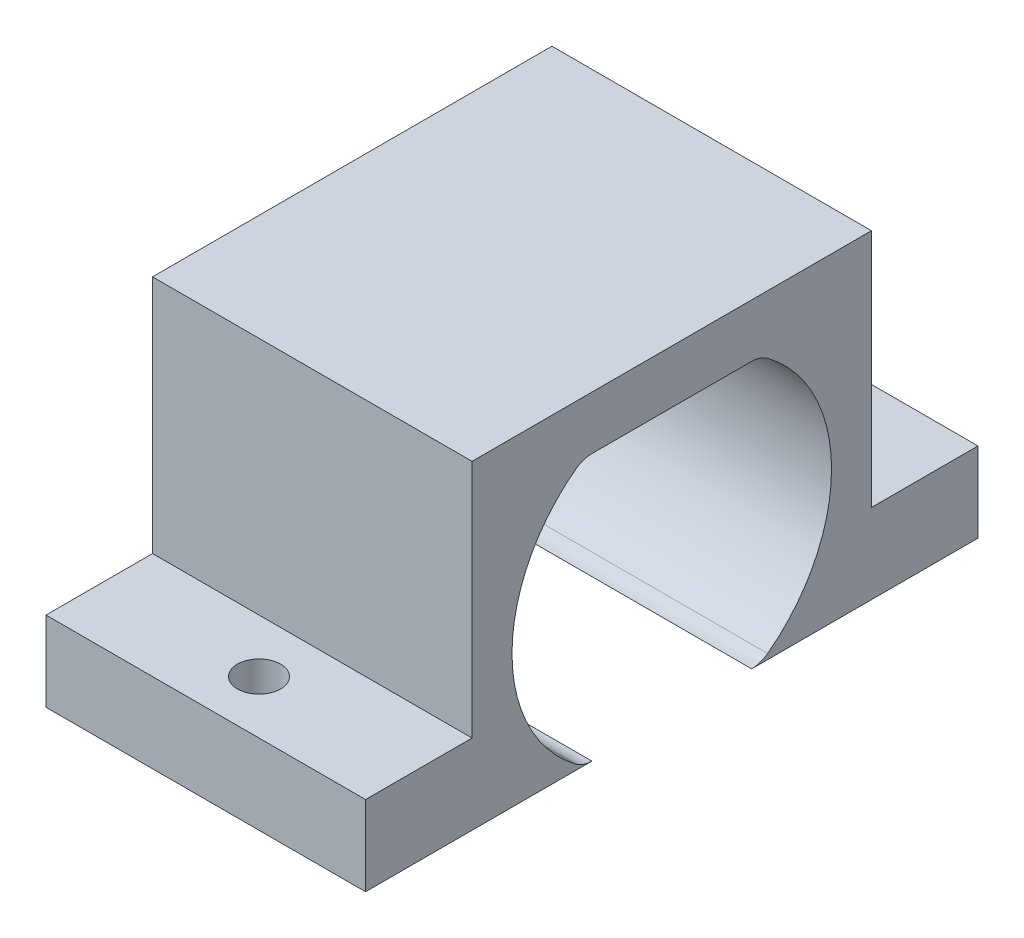
from build123d import *

# Parameters (mm, degrees)
CROQUIS1_W              = 4
CROQUIS1_H              = 3
CROQUIS1_W_2            = 15
CROQUIS1_H_2            = 12
SALIENTE_EXTRUIR1_DEPTH = 12
CORTAR_EXTRUIR2_DEPTH   = 12
CROQUIS5_R              = 0.81
CORTAR_EXTRUIR3_DEPTH   = 3


with BuildPart() as part:
    # Croquis1 → Saliente-Extruir1 (new body)
    with BuildSketch(Plane(origin=(0, 0, 0), x_dir=(0, 0, -1), z_dir=(1, 0, 0))):
        with Locations((-9.5, -4.5)):
            Rectangle(CROQUIS1_W, CROQUIS1_H)
        Rectangle(CROQUIS1_W_2, CROQUIS1_H_2)
        with Locations((9.5, -4.5)):
            Rectangle(CROQUIS1_W, CROQUIS1_H)
    extrude(amount=SALIENTE_EXTRUIR1_DEPTH)

    # Croquis4 → Cortar-Extruir2 (cut)
    with BuildSketch(Plane(origin=(12, 0, 0), x_dir=(0, 0, -1), z_dir=(1, 0, 0))):
        with BuildLine():
            Line((-3, -6), (3, -6))
            ThreePointArc((3, -6), (3.316227766, -5.948683298), (3.6, -5.8))
            ThreePointArc((3.6, -5.8), (6, -1), (3.6, 3.799999999))
            ThreePointArc((3.6, 3.799999999), (3.316227766, 3.948683297), (3, 3.999999999))
            Line((3, 3.999999999), (-3, 3.999999999))
            ThreePointArc((-3, 3.999999999), (-3.316227766, 3.948683297), (-3.6, 3.799999999))
            ThreePointArc((-3.6, 3.799999999), (-6, -1), (-3.6, -5.8))
            ThreePointArc((-3.6, -5.8), (-3.316227766, -5.948683298), (-3, -6))
        make_face()
    extrude(amount=-CORTAR_EXTRUIR2_DEPTH, mode=Mode.SUBTRACT)

    # Croquis5 → Cortar-Extruir3 (cut)
    with BuildSketch(Plane(origin=(0, -3, 0), x_dir=(1, 0, 0), z_dir=(0, 1, 0))):
        with Locations(Location((6, 9.5, 0), (0, 0, 270))):
            Circle(CROQUIS5_R)
        with Locations(Location((6, -9.5, 0), (0, 0, 90))):
            Circle(CROQUIS5_R)
    extrude(amount=-CORTAR_EXTRUIR3_DEPTH, mode=Mode.SUBTRACT)


solid = part.part
